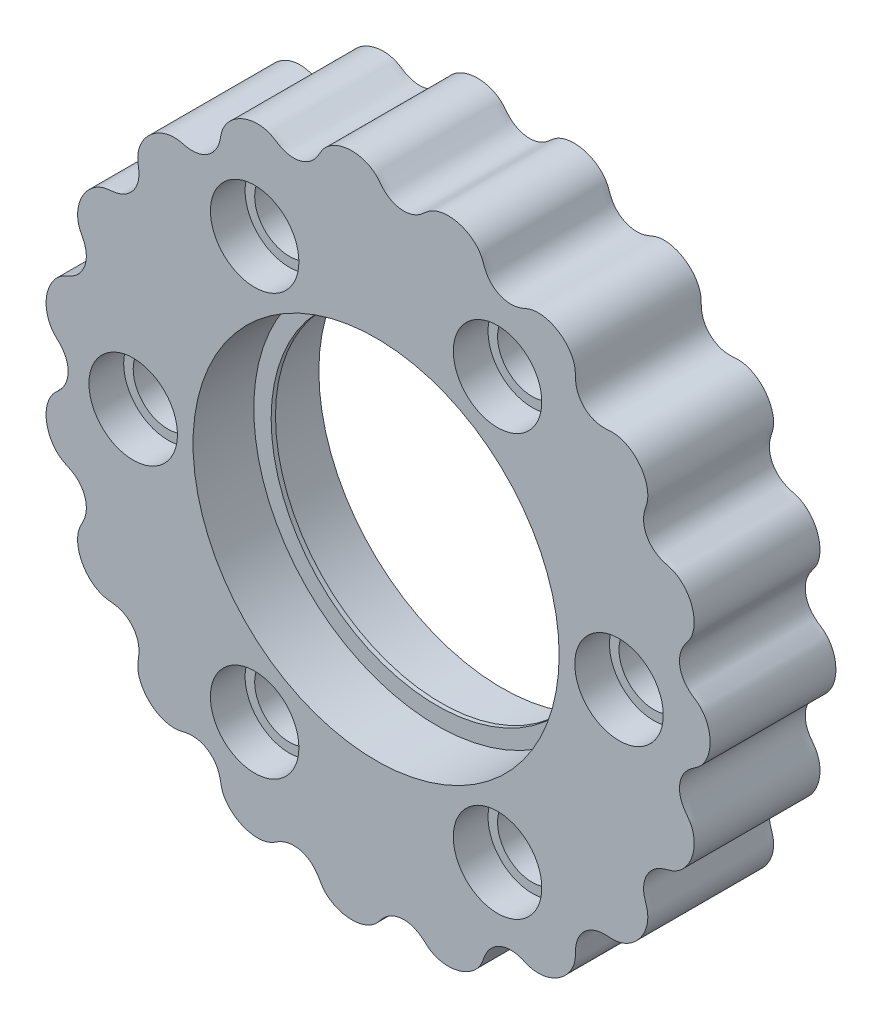
from build123d import *

# Parameters (mm, degrees)
LOBEBASE_DEPTH      = 7.25
LOBEBASE_DEPTH_BACK = 7.25
SKETCH5_R           = 21.1
CUT_EXTRUDE1_DEPTH  = 7
CUT_EXTRUDE2_START  = -7
SKETCH6_R           = 21.1
CUT_EXTRUDE2_DEPTH  = 7
SKETCH7_R           = 19.1
CUT_EXTRUDE3_DEPTH  = 57.265991747
SKETCH8_R           = 5.1
CUT_EXTRUDE4_DEPTH  = 4
SKETCH10_R          = 4
CUT_EXTRUDE5_DEPTH  = 57.265991747
CIRPATTERN1_COUNT   = 6


with BuildPart() as part:
    # LobeBaseSketch → LobeBase (new, two sides: drawn at the far end of the back side and taken through both)
    with BuildSketch(Plane.XY.offset(-LOBEBASE_DEPTH_BACK)):
        with BuildLine():
            add(Edge.make_bspline(
                [(38.5, 0), (38.5, 0.117207131), (38.491188641, 0.350596331), (38.451924314, 0.696154768), (38.387949005, 1.031810236), (38.301399075, 1.353038855), (38.195142317, 1.655817646), (38.072654089, 1.936771964), (37.937855755, 2.193307985), (37.794911074, 2.42372926), (37.647971127, 2.62733921), (37.500848555, 2.804536836), (37.356582447, 2.956923814), (37.216815665, 3.087465094), (37.080823073, 3.200802718), (36.943847802, 3.303973606), (36.794013033, 3.408218255), (36.606382019, 3.533884271), (36.333173002, 3.723953805), (35.90671922, 4.074791001), (35.344303574, 4.750939097), (34.931529824, 5.829041366), (34.97187912, 6.982756498), (35.284276606, 7.804885086), (35.573707295, 8.275182273), (35.770397617, 8.543664137), (35.907058576, 8.723444913), (36.014926702, 8.870692569), (36.110980742, 9.012749171), (36.202804215, 9.164102573), (36.292611362, 9.332952966), (36.379580764, 9.523926326), (36.461195853, 9.739293517), (36.534062147, 9.979582641), (36.594444025, 10.243933117), (36.638641503, 10.530338257), (36.663267263, 10.835841558), (36.665454624, 11.156716472), (36.643012278, 11.488642754), (36.594534076, 11.826884233), (36.519468313, 12.166468466), (36.418149075, 12.502366369), (36.291791427, 12.829668576), (36.142451909, 13.143754597), (35.972955806, 13.440450577), (35.786792629, 13.716171427), (35.587981042, 13.968043315), (35.380903846, 14.19400289), (35.170112148, 14.392870135), (34.960094938, 14.564392488), (34.75500456, 14.709258966), (34.55831752, 14.829084915), (34.372388176, 14.926372017), (34.19780766, 15.004458011), (34.032382855, 15.067497967), (33.869329749, 15.120602974), (33.69376526, 15.170548091), (33.475496922, 15.228481485), (33.155375648, 15.319541704), (32.638111656, 15.512900257), (31.886624314, 15.969796722), (31.146156549, 16.855457019), (30.809708917, 17.959762078), (30.838235131, 18.838780769), (30.959278419, 19.377573948), (31.058135598, 19.695373968), (31.129017167, 19.909787466), (31.183229464, 20.084081561), (31.227953328, 20.249629841), (31.265657183, 20.422597531), (31.295772698, 20.611459477), (31.316020909, 20.820324292), (31.323284256, 21.050522671), (31.314180702, 21.301451914), (31.285456464, 21.571085116), (31.234263603, 21.856322933), (31.158358312, 22.153269194), (31.056239242, 22.457468455), (30.927236596, 22.764123037), (30.771558249, 23.068296813), (30.590296935, 23.365107622), (30.385401582, 23.649907348), (30.159615487, 23.918447157), (29.916384032, 24.167024669), (29.659734668, 24.392609548), (29.394131911, 24.592943997), (29.124309817, 24.766614755), (28.85508368, 24.913093361), (28.591141168, 25.032741478), (28.336810054, 25.1267778), (28.09579397, 25.197202275), (27.870856554, 25.246671546), (27.663412304, 25.278316206), (27.472936562, 25.295485084), (27.296005888, 25.301396015), (27.124544282, 25.29868039), (26.942275208, 25.288913645), (26.717022309, 25.272836435), (26.384678883, 25.255019553), (25.832658261, 25.269946062), (24.973534536, 25.458079076), (23.98561393, 26.055322364), (23.308828692, 26.990548762), (23.050392374, 27.831202242), (22.989931344, 28.380104812), (22.98024267, 28.712784423), (22.977663732, 28.938595615), (22.972345457, 29.121048679), (22.96089262, 29.292148912), (22.940391059, 29.467987157), (22.907551459, 29.656394533), (22.858884271, 29.86051706), (22.791008778, 30.08060106), (22.700921888, 30.314978346), (22.58620425, 30.560675333), (22.445168593, 30.813835883), (22.276957767, 31.070046369), (22.081598451, 31.324605267), (21.860014944, 31.572757368), (21.614006615, 31.809901492), (21.346192227, 32.031774821), (21.05992435, 32.2346139), (20.759177235, 32.415290856), (20.448411745, 32.571422628), (20.132421061, 32.701450784), (19.816160905, 32.804689486), (19.504567712, 32.881339192), (19.202367464, 32.9324636), (18.913876406, 32.959926858), (18.642792109, 32.966286855), (18.391968152, 32.954637743), (18.163155819, 32.928389573), (17.956676467, 32.8909626), (17.7709465, 32.845353849), (17.601683142, 32.793495214), (17.440393561, 32.735253236), (17.271171585, 32.666833009), (17.063343771, 32.57848741), (16.754792761, 32.453724161), (16.227835509, 32.288601108), (15.354174788, 32.187583538), (14.225857866, 32.431689242), (13.282075205, 33.096490686), (12.76468194, 33.807681107), (12.529268482, 34.307210957), (12.412083874, 34.618719162), (12.336323896, 34.8314579), (12.272051367, 35.002298313), (12.205662921, 35.160409133), (12.129177606, 35.320063131), (12.036941571, 35.487599075), (11.92463283, 35.664859471), (11.78897386, 35.850979577), (11.627665946, 36.043406488), (11.439386346, 36.238542179), (11.223791293, 36.432191589), (10.981503184, 36.619901918), (10.714073836, 36.797235047), (10.423921479, 36.959993535), (10.114241988, 37.104409764), (9.788896371, 37.227302193), (9.452277535, 37.326199864), (9.109160017, 37.399434816), (8.764536755, 37.446201548), (8.423447245, 37.466582412), (8.090801385, 37.461537852), (7.771203052, 37.432860321), (7.468776779, 37.383090408), (7.186999657, 37.315392737), (6.928538367, 37.233387205), (6.695087203, 37.140926868), (6.487195321, 37.041805653), (6.304056108, 36.939362841), (6.143198641, 36.835918876), (5.99994491, 36.731910362), (5.866305582, 36.624453454), (5.728468531, 36.504794138), (5.56058717, 36.353753766), (5.309264865, 36.135564185), (4.864474979, 35.808285215), (4.070951957, 35.429063883), (2.924509365, 35.29357936), (1.816002776, 35.615914299), (1.095720153, 36.120573143), (0.710864969, 36.516598464), (0.498883197, 36.773178515), (0.358151948, 36.949791257), (0.24189009, 37.090505809), (0.127760255, 37.218493455), (0.003579557, 37.344662218), (-0.138057708, 37.473171611), (-0.301837608, 37.604360961), (-0.4905793, 37.73634817), (-0.705628023, 37.865972267), (-0.94706657, 37.989400681), (-1.213857949, 38.102554033), (-1.503967664, 38.201422879), (-1.814486925, 38.282313442), (-2.141765622, 38.34204091), (-2.481557696, 38.378079503), (-2.829178297, 38.388673732), (-3.179670217, 38.372912897), (-3.527976032, 38.330769701), (-3.869111788, 38.263103492), (-4.198337784, 38.171628482), (-4.511322007, 38.058847316), (-4.804292042, 37.927950204), (-5.074171761, 37.782679311), (-5.318700024, 37.627156806), (-5.536530015, 37.465672315), (-5.727310328, 37.302420266), (-5.891753449, 37.141167328), (-6.031706547, 36.984809945), (-6.150260113, 36.834740525), (-6.251980453, 36.689853069), (-6.343487632, 36.544825853), (-6.435002975, 36.386894391), (-6.544745332, 36.189526815), (-6.71160426, 35.901555128), (-7.026026895, 35.447585996), (-7.653421686, 34.831255417), (-8.693755104, 34.330862519), (-9.846861732, 34.275800961), (-10.691979914, 34.519240611), (-11.184571794, 34.768845913), (-11.468379215, 34.942693381), (-11.658831321, 35.064041395), (-11.814483731, 35.159381481), (-11.963987218, 35.243376507), (-12.122406393, 35.322387691), (-12.298096292, 35.397944547), (-12.495599257, 35.468846449), (-12.716970581, 35.5323979), (-12.962456246, 35.5851724), (-13.230890128, 35.623518154), (-13.519966847, 35.643913526), (-13.826460279, 35.643226914), (-14.146419873, 35.618909164), (-14.475359185, 35.569133214), (-14.808442099, 35.49288883), (-15.140667598, 35.390036811), (-15.467051363, 35.2613254), (-15.782801135, 35.108370926), (-16.083482033, 34.93360446), (-16.365167769, 34.740186312), (-16.624573659, 34.531890129), (-16.859167547, 34.312958169), (-17.067255056, 34.087928653), (-17.248036028, 33.861434588), (-17.401629461, 33.637970491), (-17.529064917, 33.421617621), (-17.632239313, 33.215707218), (-17.713840207, 33.022379013), (-17.777242753, 32.841946488), (-17.826406724, 32.671880893), (-17.865865531, 32.50499932), (-17.901142059, 32.325910037), (-17.940853125, 32.103603095), (-18.005166922, 31.777055503), (-18.155149736, 31.245590808), (-18.548428335, 30.458939965), (-19.369916309, 29.647864025), (-20.442665981, 29.221372744), (-21.321038055, 29.177212737), (-21.867986657, 29.253349414), (-22.192864789, 29.325625227), (-22.41239931, 29.378558574), (-22.590574919, 29.418192616), (-22.759251035, 29.449092857), (-22.934741512, 29.472384375), (-23.125445318, 29.486800935), (-23.335268838, 29.489732068), (-23.565280775, 29.477960975), (-23.814601202, 29.448166942), (-24.080941442, 29.397274678), (-24.360977554, 29.322701915), (-24.650641383, 29.222534252), (-24.945368724, 29.095643394), (-25.240322971, 28.941758023), (-25.530602023, 28.761492924), (-25.811430632, 28.556340268), (-26.078337499, 28.328626161), (-26.32731484, 28.081435399), (-26.554957439, 27.818507334), (-26.758577895, 27.544105906), (-26.936294798, 27.26286683), (-27.087090651, 26.979624697), (-27.21083644, 26.699221996), (-27.308279698, 26.426300519), (-27.380992342, 26.165072617), (-27.431273331, 25.919064117), (-27.461998455, 25.690809836), (-27.476404422, 25.481460919), (-27.477785297, 25.290217953), (-27.469065221, 25.113403467), (-27.452199683, 24.942751743), (-27.427414636, 24.761911742), (-27.392791101, 24.538755841), (-27.347590369, 24.209018843), (-27.316880396, 23.657651031), (-27.433424965, 22.785925748), (-27.947046528, 21.75205943), (-28.823190171, 21.000355374), (-29.639630892, 20.673381133), (-30.181665849, 20.567798593), (-30.512409106, 20.530670546), (-30.737236071, 20.509453076), (-30.918626786, 20.489086111), (-31.088196856, 20.463543046), (-31.261741519, 20.428590901), (-31.446793516, 20.380304907), (-31.646199956, 20.314947638), (-31.859927145, 20.229129581), (-32.086064596, 20.11999566), (-32.321449096, 19.985380346), (-32.562098343, 19.823920564), (-32.803543, 19.635126569), (-33.041099805, 19.419413196), (-33.27010612, 19.178094272), (-33.486125071, 18.913342979), (-33.685124652, 18.628121159), (-33.863631119, 18.326080713), (-34.018855472, 18.011440618), (-34.148791164, 17.68884329), (-34.252280904, 17.363194234), (-34.329050437, 17.039488882), (-34.379707183, 16.722630256), (-34.405701477, 16.417240355), (-34.409247532, 16.127466743), (-34.393199842, 15.856783131), (-34.360877639, 15.607777841), (-34.315823948, 15.381914575), (-34.261473877, 15.17923115), (-34.200683444, 14.997901885), (-34.135024275, 14.8334991), (-34.063662035, 14.677569989), (-33.981501257, 14.514576089), (-33.876295118, 14.314753634), (-33.726478059, 14.017559349), (-33.5184032, 13.506037678), (-33.345584326, 12.643702916), (-33.495680612, 11.499081678), (-34.080274467, 10.503623646), (-34.746309815, 9.929267901), (-35.224693229, 9.653407652), (-35.525460447, 9.510899146), (-35.731216365, 9.4178301), (-35.896165688, 9.339669205), (-36.048254165, 9.260450822), (-36.201046756, 9.17104262), (-36.360393689, 9.065286609), (-36.527774268, 8.938723412), (-36.70205605, 8.78815811), (-36.880505025, 8.611510655), (-37.059426222, 8.407759947), (-37.234610523, 8.176909819), (-37.401671733, 7.919948252), (-37.556315038, 7.638788256), (-37.694557032, 7.336186427), (-37.812906876, 7.015638852), (-37.908512738, 6.681256078), (-37.979274859, 6.337620062), (-38.023925257, 5.989626769), (-38.042073493, 5.642318604), (-38.034217798, 5.300711049), (-38.00172079, 4.96961792), (-37.946748986, 4.653479349), (-37.872174899, 4.356195982), (-37.78143948, 4.080971701), (-37.678370474, 3.830165151), (-37.566947692, 3.605146655), (-37.450997451, 3.406150194), (-37.333781016, 3.232096155), (-37.21740686, 3.080330432), (-37.101923789, 2.94615494), (-36.983798052, 2.82184578), (-36.85316494, 2.6943609), (-36.688776914, 2.539525754), (-36.45057853, 2.307079795), (-36.087686926, 1.890835575), (-35.644232216, 1.131338686), (-35.414537962, 0), (-35.644232216, -1.131338686), (-36.087686926, -1.890835575), (-36.45057853, -2.307079795), (-36.688776914, -2.539525754), (-36.85316494, -2.6943609), (-36.983798052, -2.82184578), (-37.101923789, -2.94615494), (-37.21740686, -3.080330432), (-37.333781016, -3.232096155), (-37.450997451, -3.406150194), (-37.566947692, -3.605146655), (-37.678370474, -3.830165151), (-37.78143948, -4.080971701), (-37.872174899, -4.356195982), (-37.946748986, -4.653479349), (-38.00172079, -4.96961792), (-38.034217798, -5.300711049), (-38.042073493, -5.642318604), (-38.023925257, -5.989626769), (-37.979274859, -6.337620062), (-37.908512738, -6.681256078), (-37.812906876, -7.015638852), (-37.694557032, -7.336186427), (-37.556315038, -7.638788256), (-37.401671733, -7.919948252), (-37.234610523, -8.176909819), (-37.059426222, -8.407759947), (-36.880505025, -8.611510655), (-36.70205605, -8.78815811), (-36.527774268, -8.938723412), (-36.360393689, -9.065286609), (-36.201046756, -9.17104262), (-36.048254165, -9.260450822), (-35.896165688, -9.339669205), (-35.731216365, -9.4178301), (-35.525460447, -9.510899146), (-35.224693229, -9.653407652), (-34.746309815, -9.929267901), (-34.080274467, -10.503623646), (-33.495680612, -11.499081678), (-33.345584326, -12.643702916), (-33.5184032, -13.506037678), (-33.726478059, -14.017559349), (-33.876295118, -14.314753634), (-33.981501257, -14.514576089), (-34.063662035, -14.677569989), (-34.135024275, -14.8334991), (-34.200683444, -14.997901885), (-34.261473877, -15.17923115), (-34.315823948, -15.381914575), (-34.360877639, -15.607777841), (-34.393199842, -15.856783131), (-34.409247532, -16.127466743), (-34.405701477, -16.417240355), (-34.379707183, -16.722630256), (-34.329050437, -17.039488882), (-34.252280904, -17.363194234), (-34.148791164, -17.68884329), (-34.018855472, -18.011440618), (-33.863631119, -18.326080713), (-33.685124652, -18.628121159), (-33.486125071, -18.913342979), (-33.27010612, -19.178094272), (-33.041099805, -19.419413196), (-32.803543, -19.635126569), (-32.562098343, -19.823920564), (-32.321449096, -19.985380346), (-32.086064596, -20.11999566), (-31.859927145, -20.229129581), (-31.646199956, -20.314947638), (-31.446793516, -20.380304907), (-31.261741519, -20.428590901), (-31.088196856, -20.463543046), (-30.918626786, -20.489086111), (-30.737236071, -20.509453076), (-30.512409106, -20.530670546), (-30.181665849, -20.567798593), (-29.639630892, -20.673381133), (-28.823190171, -21.000355374), (-27.947046528, -21.75205943), (-27.433424965, -22.785925748), (-27.316880396, -23.657651031), (-27.347590369, -24.209018843), (-27.392791101, -24.538755841), (-27.427414636, -24.761911742), (-27.452199683, -24.942751743), (-27.469065221, -25.113403467), (-27.477785297, -25.290217953), (-27.476404422, -25.481460919), (-27.461998455, -25.690809836), (-27.431273331, -25.919064117), (-27.380992342, -26.165072617), (-27.308279698, -26.426300519), (-27.21083644, -26.699221996), (-27.087090651, -26.979624697), (-26.936294798, -27.26286683), (-26.758577895, -27.544105906), (-26.554957439, -27.818507334), (-26.32731484, -28.081435399), (-26.078337499, -28.328626161), (-25.811430632, -28.556340268), (-25.530602023, -28.761492924), (-25.240322971, -28.941758023), (-24.945368724, -29.095643394), (-24.650641383, -29.222534252), (-24.360977554, -29.322701915), (-24.080941442, -29.397274678), (-23.814601202, -29.448166942), (-23.565280775, -29.477960975), (-23.335268838, -29.489732068), (-23.125445318, -29.486800935), (-22.934741512, -29.472384375), (-22.759251035, -29.449092857), (-22.590574919, -29.418192616), (-22.41239931, -29.378558574), (-22.192864789, -29.325625227), (-21.867986657, -29.253349414), (-21.321038055, -29.177212737), (-20.442665981, -29.221372744), (-19.369916309, -29.647864025), (-18.548428335, -30.458939965), (-18.155149736, -31.245590808), (-18.005166922, -31.777055503), (-17.940853125, -32.103603095), (-17.901142059, -32.325910037), (-17.865865531, -32.50499932), (-17.826406724, -32.671880893), (-17.777242753, -32.841946488), (-17.713840207, -33.022379013), (-17.632239313, -33.215707218), (-17.529064917, -33.421617621), (-17.401629461, -33.637970491), (-17.248036028, -33.861434588), (-17.067255056, -34.087928653), (-16.859167547, -34.312958169), (-16.624573659, -34.531890129), (-16.365167769, -34.740186312), (-16.083482033, -34.93360446), (-15.782801135, -35.108370926), (-15.467051363, -35.2613254), (-15.140667598, -35.390036811), (-14.808442099, -35.49288883), (-14.475359185, -35.569133214), (-14.146419873, -35.618909164), (-13.826460279, -35.643226914), (-13.519966847, -35.643913526), (-13.230890128, -35.623518154), (-12.962456246, -35.5851724), (-12.716970581, -35.5323979), (-12.495599257, -35.468846449), (-12.298096292, -35.397944547), (-12.122406393, -35.322387691), (-11.963987218, -35.243376507), (-11.814483731, -35.159381481), (-11.658831321, -35.064041395), (-11.468379215, -34.942693381), (-11.184571794, -34.768845913), (-10.691979914, -34.519240611), (-9.846861732, -34.275800961), (-8.693755104, -34.330862519), (-7.653421686, -34.831255417), (-7.026026895, -35.447585996), (-6.71160426, -35.901555128), (-6.544745332, -36.189526815), (-6.435002975, -36.386894391), (-6.343487632, -36.544825853), (-6.251980453, -36.689853069), (-6.150260113, -36.834740525), (-6.031706547, -36.984809945), (-5.891753449, -37.141167328), (-5.727310328, -37.302420266), (-5.536530015, -37.465672315), (-5.318700024, -37.627156806), (-5.074171761, -37.782679311), (-4.804292042, -37.927950204), (-4.511322007, -38.058847316), (-4.198337784, -38.171628482), (-3.869111788, -38.263103492), (-3.527976032, -38.330769701), (-3.179670217, -38.372912897), (-2.829178297, -38.388673732), (-2.481557696, -38.378079503), (-2.141765622, -38.34204091), (-1.814486925, -38.282313442), (-1.503967664, -38.201422879), (-1.213857949, -38.102554033), (-0.94706657, -37.989400681), (-0.705628023, -37.865972267), (-0.4905793, -37.73634817), (-0.301837608, -37.604360961), (-0.138057708, -37.473171611), (0.003579557, -37.344662218), (0.127760255, -37.218493455), (0.24189009, -37.090505809), (0.358151948, -36.949791257), (0.498883197, -36.773178515), (0.710864969, -36.516598464), (1.095720153, -36.120573143), (1.816002776, -35.615914299), (2.924509365, -35.29357936), (4.070951957, -35.429063883), (4.864474979, -35.808285215), (5.309264865, -36.135564185), (5.56058717, -36.353753766), (5.728468531, -36.504794138), (5.866305582, -36.624453454), (5.99994491, -36.731910362), (6.143198641, -36.835918876), (6.304056108, -36.939362841), (6.487195321, -37.041805653), (6.695087203, -37.140926868), (6.928538367, -37.233387205), (7.186999657, -37.315392737), (7.468776779, -37.383090408), (7.771203052, -37.432860321), (8.090801385, -37.461537852), (8.423447245, -37.466582412), (8.764536755, -37.446201548), (9.109160017, -37.399434816), (9.452277535, -37.326199864), (9.788896371, -37.227302193), (10.114241988, -37.104409764), (10.423921479, -36.959993535), (10.714073836, -36.797235047), (10.981503184, -36.619901918), (11.223791293, -36.432191589), (11.439386346, -36.238542179), (11.627665946, -36.043406488), (11.78897386, -35.850979577), (11.92463283, -35.664859471), (12.036941571, -35.487599075), (12.129177606, -35.320063131), (12.205662921, -35.160409133), (12.272051367, -35.002298313), (12.336323896, -34.8314579), (12.412083874, -34.618719162), (12.529268482, -34.307210957), (12.76468194, -33.807681107), (13.282075205, -33.096490686), (14.225857866, -32.431689242), (15.354174788, -32.187583538), (16.227835509, -32.288601108), (16.754792761, -32.453724161), (17.063343771, -32.57848741), (17.271171585, -32.666833009), (17.440393561, -32.735253236), (17.601683142, -32.793495214), (17.7709465, -32.845353849), (17.956676467, -32.8909626), (18.163155819, -32.928389573), (18.391968152, -32.954637743), (18.642792109, -32.966286855), (18.913876406, -32.959926858), (19.202367464, -32.9324636), (19.504567712, -32.881339192), (19.816160905, -32.804689486), (20.132421061, -32.701450784), (20.448411745, -32.571422628), (20.759177235, -32.415290856), (21.05992435, -32.2346139), (21.346192227, -32.031774821), (21.614006615, -31.809901492), (21.860014944, -31.572757368), (22.081598451, -31.324605267), (22.276957767, -31.070046369), (22.445168593, -30.813835883), (22.58620425, -30.560675333), (22.700921888, -30.314978346), (22.791008778, -30.08060106), (22.858884271, -29.86051706), (22.907551459, -29.656394533), (22.940391059, -29.467987157), (22.96089262, -29.292148912), (22.972345457, -29.121048679), (22.977663732, -28.938595615), (22.98024267, -28.712784423), (22.989931344, -28.380104812), (23.050392374, -27.831202242), (23.308828692, -26.990548762), (23.98561393, -26.055322364), (24.973534536, -25.458079076), (25.832658261, -25.269946062), (26.384678883, -25.255019553), (26.717022309, -25.272836435), (26.942275208, -25.288913645), (27.124544282, -25.29868039), (27.296005888, -25.301396015), (27.472936562, -25.295485084), (27.663412304, -25.278316206), (27.870856554, -25.246671546), (28.09579397, -25.197202275), (28.336810054, -25.1267778), (28.591141168, -25.032741478), (28.85508368, -24.913093361), (29.124309817, -24.766614755), (29.394131911, -24.592943997), (29.659734668, -24.392609548), (29.916384032, -24.167024669), (30.159615487, -23.918447157), (30.385401582, -23.649907348), (30.590296935, -23.365107622), (30.771558249, -23.068296813), (30.927236596, -22.764123037), (31.056239242, -22.457468455), (31.158358312, -22.153269194), (31.234263603, -21.856322933), (31.285456464, -21.571085116), (31.314180702, -21.301451914), (31.323284256, -21.050522671), (31.316020909, -20.820324292), (31.295772698, -20.611459477), (31.265657183, -20.422597531), (31.227953328, -20.249629841), (31.183229464, -20.084081561), (31.129017167, -19.909787466), (31.058135598, -19.695373968), (30.959278419, -19.377573948), (30.838235131, -18.838780769), (30.809708917, -17.959762078), (31.146156549, -16.855457019), (31.886624314, -15.969796722), (32.638111656, -15.512900257), (33.155375648, -15.319541704), (33.475496922, -15.228481485), (33.69376526, -15.170548091), (33.869329749, -15.120602974), (34.032382855, -15.067497967), (34.19780766, -15.004458011), (34.372388176, -14.926372017), (34.55831752, -14.829084915), (34.75500456, -14.709258966), (34.960094938, -14.564392488), (35.170112148, -14.392870135), (35.380903846, -14.19400289), (35.587981042, -13.968043315), (35.786792629, -13.716171427), (35.972955806, -13.440450577), (36.142451909, -13.143754597), (36.291791427, -12.829668576), (36.418149075, -12.502366369), (36.519468313, -12.166468466), (36.594534076, -11.826884233), (36.643012278, -11.488642754), (36.665454624, -11.156716472), (36.663267263, -10.835841558), (36.638641503, -10.530338257), (36.594444025, -10.243933117), (36.534062147, -9.979582641), (36.461195853, -9.739293517), (36.379580764, -9.523926326), (36.292611362, -9.332952966), (36.202804215, -9.164102573), (36.110980742, -9.012749171), (36.014926702, -8.870692569), (35.907058576, -8.723444913), (35.770397617, -8.543664137), (35.573707295, -8.275182273), (35.284276606, -7.804885086), (34.97187912, -6.982756498), (34.931529824, -5.829041366), (35.344303574, -4.750939097), (35.90671922, -4.074791001), (36.333173002, -3.723953805), (36.606382019, -3.533884271), (36.794013033, -3.408218255), (36.943847802, -3.303973606), (37.080823073, -3.200802718), (37.216815665, -3.087465094), (37.356582447, -2.956923814), (37.500848555, -2.804536836), (37.647971127, -2.62733921), (37.794911074, -2.42372926), (37.937855755, -2.193307985), (38.072654089, -1.936771964), (38.195142317, -1.655817646), (38.301399075, -1.353038855), (38.387949005, -1.031810236), (38.451924314, -0.696154768), (38.491188641, -0.350596331), (38.5, -0.117207131), (38.5, 0)],
                knots=[0, 0, 0, 0, 0.001307561, 0.002603687, 0.003877103, 0.005116864, 0.006312543, 0.007454444, 0.008533868, 0.009543461, 0.010477685, 0.011333521, 0.012111543, 0.012817691, 0.013466347, 0.014086028, 0.014730603, 0.015502879, 0.016606009, 0.018443649, 0.021651303, 0.026315789, 0.030980276, 0.03418793, 0.03602557, 0.0371287, 0.037900976, 0.038545551, 0.039165232, 0.039813888, 0.040520036, 0.041298058, 0.042153894, 0.043088118, 0.044097711, 0.045177135, 0.046319036, 0.047514715, 0.048754476, 0.050027892, 0.051324018, 0.052631579, 0.05393914, 0.055235266, 0.056508682, 0.057748443, 0.058944122, 0.060086023, 0.061165447, 0.06217504, 0.063109264, 0.0639651, 0.064743122, 0.06544927, 0.066097926, 0.066717607, 0.067362182, 0.068134458, 0.069237588, 0.071075228, 0.074282882, 0.078947368, 0.083611855, 0.086819509, 0.088657148, 0.089760278, 0.090532555, 0.09117713, 0.091796811, 0.092445467, 0.093151615, 0.093929637, 0.094785473, 0.095719697, 0.09672929, 0.097808714, 0.098950615, 0.100146293, 0.101386055, 0.102659471, 0.103955597, 0.105263158, 0.106570719, 0.107866845, 0.109140261, 0.110380022, 0.111575701, 0.112717602, 0.113797026, 0.114806619, 0.115740843, 0.116596679, 0.117374701, 0.118080849, 0.118729505, 0.119349186, 0.119993761, 0.120766037, 0.121869167, 0.123706807, 0.126914461, 0.131578947, 0.136243434, 0.139451088, 0.141288727, 0.142391857, 0.143164134, 0.143808709, 0.14442839, 0.145077046, 0.145783194, 0.146561216, 0.147417052, 0.148351276, 0.149360869, 0.150440293, 0.151582193, 0.152777872, 0.154017634, 0.15529105, 0.156587175, 0.157894737, 0.159202298, 0.160498424, 0.16177184, 0.163011601, 0.16420728, 0.165349181, 0.166428605, 0.167438198, 0.168372422, 0.169228258, 0.17000628, 0.170712428, 0.171361084, 0.171980765, 0.17262534, 0.173397616, 0.174500746, 0.176338386, 0.17954604, 0.184210526, 0.188875012, 0.192082667, 0.193920306, 0.195023436, 0.195795713, 0.196440288, 0.197059969, 0.197708625, 0.198414773, 0.199192795, 0.200048631, 0.200982855, 0.201992448, 0.203071872, 0.204213772, 0.205409451, 0.206649213, 0.207922629, 0.209218754, 0.210526316, 0.211833877, 0.213130003, 0.214403419, 0.21564318, 0.216838859, 0.21798076, 0.219060184, 0.220069777, 0.221004001, 0.221859837, 0.222637859, 0.223344007, 0.223992663, 0.224612344, 0.225256919, 0.226029195, 0.227132325, 0.228969965, 0.232177619, 0.236842105, 0.241506591, 0.244714246, 0.246551885, 0.247655015, 0.248427291, 0.249071867, 0.249691547, 0.250340204, 0.251046351, 0.251824374, 0.25268021, 0.253614434, 0.254624026, 0.255703451, 0.256845351, 0.25804103, 0.259280792, 0.260554208, 0.261850333, 0.263157895, 0.264465456, 0.265761582, 0.267034998, 0.268274759, 0.269470438, 0.270612339, 0.271691763, 0.272701355, 0.27363558, 0.274491416, 0.275269438, 0.275975586, 0.276624242, 0.277243922, 0.277888498, 0.278660774, 0.279763904, 0.281601544, 0.284809198, 0.289473684, 0.29413817, 0.297345825, 0.299183464, 0.300286594, 0.30105887, 0.301703446, 0.302323126, 0.302971783, 0.30367793, 0.304455952, 0.305311788, 0.306246013, 0.307255605, 0.30833503, 0.30947693, 0.310672609, 0.311912371, 0.313185786, 0.314481912, 0.315789474, 0.317097035, 0.318393161, 0.319666577, 0.320906338, 0.322102017, 0.323243918, 0.324323342, 0.325332934, 0.326267159, 0.327122995, 0.327901017, 0.328607165, 0.329255821, 0.329875501, 0.330520077, 0.331292353, 0.332395483, 0.334233123, 0.337440777, 0.342105263, 0.346769749, 0.349977404, 0.351815043, 0.352918173, 0.353690449, 0.354335025, 0.354954705, 0.355603362, 0.356309509, 0.357087531, 0.357943367, 0.358877592, 0.359887184, 0.360966609, 0.362108509, 0.363304188, 0.36454395, 0.365817365, 0.367113491, 0.368421053, 0.369728614, 0.37102474, 0.372298156, 0.373537917, 0.374733596, 0.375875497, 0.376954921, 0.377964513, 0.378898738, 0.379754574, 0.380532596, 0.381238744, 0.3818874, 0.38250708, 0.383151656, 0.383923932, 0.385027062, 0.386864702, 0.390072356, 0.394736842, 0.399401328, 0.402608983, 0.404446622, 0.405549752, 0.406322028, 0.406966604, 0.407586284, 0.408234941, 0.408941088, 0.40971911, 0.410574946, 0.411509171, 0.412518763, 0.413598188, 0.414740088, 0.415935767, 0.417175529, 0.418448944, 0.41974507, 0.421052632, 0.422360193, 0.423656319, 0.424929735, 0.426169496, 0.427365175, 0.428507076, 0.4295865, 0.430596092, 0.431530317, 0.432386153, 0.433164175, 0.433870323, 0.434518979, 0.435138659, 0.435783235, 0.436555511, 0.437658641, 0.439496281, 0.442703935, 0.447368421, 0.452032907, 0.455240562, 0.457078201, 0.458181331, 0.458953607, 0.459598183, 0.460217863, 0.46086652, 0.461572667, 0.462350689, 0.463206525, 0.46414075, 0.465150342, 0.466229767, 0.467371667, 0.468567346, 0.469807108, 0.471080523, 0.472376649, 0.473684211, 0.474991772, 0.476287898, 0.477561314, 0.478801075, 0.479996754, 0.481138655, 0.482218079, 0.483227671, 0.484161896, 0.485017732, 0.485795754, 0.486501902, 0.487150558, 0.487770238, 0.488414814, 0.48918709, 0.49029022, 0.492127859, 0.495335514, 0.5, 0.504664486, 0.507872141, 0.50970978, 0.51081291, 0.511585186, 0.512229762, 0.512849442, 0.513498098, 0.514204246, 0.514982268, 0.515838104, 0.516772329, 0.517781921, 0.518861345, 0.520003246, 0.521198925, 0.522438686, 0.523712102, 0.525008228, 0.526315789, 0.527623351, 0.528919477, 0.530192892, 0.531432654, 0.532628333, 0.533770233, 0.534849658, 0.53585925, 0.536793475, 0.537649311, 0.538427333, 0.53913348, 0.539782137, 0.540401817, 0.541046393, 0.541818669, 0.542921799, 0.544759438, 0.547967093, 0.552631579, 0.557296065, 0.560503719, 0.562341359, 0.563444489, 0.564216765, 0.564861341, 0.565481021, 0.566129677, 0.566835825, 0.567613847, 0.568469683, 0.569403908, 0.5704135, 0.571492924, 0.572634825, 0.573830504, 0.575070265, 0.576343681, 0.577639807, 0.578947368, 0.58025493, 0.581551056, 0.582824471, 0.584064233, 0.585259912, 0.586401812, 0.587481237, 0.588490829, 0.589425054, 0.59028089, 0.591058912, 0.591765059, 0.592413716, 0.593033396, 0.593677972, 0.594450248, 0.595553378, 0.597391017, 0.600598672, 0.605263158, 0.609927644, 0.613135298, 0.614972938, 0.616076068, 0.616848344, 0.61749292, 0.6181126, 0.618761256, 0.619467404, 0.620245426, 0.621101262, 0.622035487, 0.623045079, 0.624124503, 0.625266404, 0.626462083, 0.627701844, 0.62897526, 0.630271386, 0.631578947, 0.632886509, 0.634182635, 0.63545605, 0.636695812, 0.637891491, 0.639033391, 0.640112816, 0.641122408, 0.642056633, 0.642912469, 0.643690491, 0.644396638, 0.645045295, 0.645664975, 0.646309551, 0.647081827, 0.648184957, 0.650022596, 0.653230251, 0.657894737, 0.662559223, 0.665766877, 0.667604517, 0.668707647, 0.669479923, 0.670124499, 0.670744179, 0.671392835, 0.672098983, 0.672877005, 0.673732841, 0.674667066, 0.675676658, 0.676756082, 0.677897983, 0.679093662, 0.680333423, 0.681606839, 0.682902965, 0.684210526, 0.685518088, 0.686814214, 0.688087629, 0.689327391, 0.69052307, 0.69166497, 0.692744395, 0.693753987, 0.694688212, 0.695544048, 0.69632207, 0.697028217, 0.697676874, 0.698296554, 0.69894113, 0.699713406, 0.700816536, 0.702654175, 0.70586183, 0.710526316, 0.715190802, 0.718398456, 0.720236096, 0.721339226, 0.722111502, 0.722756078, 0.723375758, 0.724024414, 0.724730562, 0.725508584, 0.72636442, 0.727298645, 0.728308237, 0.729387661, 0.730529562, 0.731725241, 0.732965002, 0.734238418, 0.735534544, 0.736842105, 0.738149667, 0.739445792, 0.740719208, 0.74195897, 0.743154649, 0.744296549, 0.745375974, 0.746385566, 0.74731979, 0.748175626, 0.748953649, 0.749659796, 0.750308453, 0.750928133, 0.751572709, 0.752344985, 0.753448115, 0.755285754, 0.758493409, 0.763157895, 0.767822381, 0.771030035, 0.772867675, 0.773970805, 0.774743081, 0.775387656, 0.776007337, 0.776655993, 0.777362141, 0.778140163, 0.778995999, 0.779930223, 0.780939816, 0.78201924, 0.783161141, 0.78435682, 0.785596581, 0.786869997, 0.788166123, 0.789473684, 0.790781246, 0.792077371, 0.793350787, 0.794590549, 0.795786228, 0.796928128, 0.798007552, 0.799017145, 0.799951369, 0.800807205, 0.801585227, 0.802291375, 0.802940031, 0.803559712, 0.804204287, 0.804976564, 0.806079694, 0.807917333, 0.811124988, 0.815789474, 0.82045396, 0.823661614, 0.825499254, 0.826602384, 0.82737466, 0.828019235, 0.828638916, 0.829287572, 0.82999372, 0.830771742, 0.831627578, 0.832561802, 0.833571395, 0.834650819, 0.83579272, 0.836988399, 0.83822816, 0.839501576, 0.840797702, 0.842105263, 0.843412825, 0.84470895, 0.845982366, 0.847222128, 0.848417807, 0.849559707, 0.850639131, 0.851648724, 0.852582948, 0.853438784, 0.854216806, 0.854922954, 0.85557161, 0.856191291, 0.856835866, 0.857608143, 0.858711273, 0.860548912, 0.863756566, 0.868421053, 0.873085539, 0.876293193, 0.878130833, 0.879233963, 0.880006239, 0.880650814, 0.881270495, 0.881919151, 0.882625299, 0.883403321, 0.884259157, 0.885193381, 0.886202974, 0.887282398, 0.888424299, 0.889619978, 0.890859739, 0.892133155, 0.893429281, 0.894736842, 0.896044403, 0.897340529, 0.898613945, 0.899853707, 0.901049385, 0.902191286, 0.90327071, 0.904280303, 0.905214527, 0.906070363, 0.906848385, 0.907554533, 0.908203189, 0.90882287, 0.909467445, 0.910239722, 0.911342852, 0.913180491, 0.916388145, 0.921052632, 0.925717118, 0.928924772, 0.930762412, 0.931865542, 0.932637818, 0.933282393, 0.933902074, 0.93455073, 0.935256878, 0.9360349, 0.936890736, 0.93782496, 0.938834553, 0.939913977, 0.941055878, 0.942251557, 0.943491318, 0.944764734, 0.94606086, 0.947368421, 0.948675982, 0.949972108, 0.951245524, 0.952485285, 0.953680964, 0.954822865, 0.955902289, 0.956911882, 0.957846106, 0.958701942, 0.959479964, 0.960186112, 0.960834768, 0.961454449, 0.962099024, 0.9628713, 0.96397443, 0.96581207, 0.969019724, 0.973684211, 0.978348697, 0.981556351, 0.983393991, 0.984497121, 0.985269397, 0.985913972, 0.986533653, 0.987182309, 0.987888457, 0.988666479, 0.989522315, 0.990456539, 0.991466132, 0.992545556, 0.993687457, 0.994883136, 0.996122897, 0.997396313, 0.998692439, 1, 1, 1, 1], degree=3))
        make_face()
    extrude(amount=LOBEBASE_DEPTH + LOBEBASE_DEPTH_BACK)

    # Sketch5 → Cut-Extrude1 (cut)
    with BuildSketch(Plane.XY.offset(7.25)):
        Circle(SKETCH5_R)
    extrude(amount=-CUT_EXTRUDE1_DEPTH, mode=Mode.SUBTRACT)

    # Sketch6 → Cut-Extrude2 (cut)
    with BuildSketch(Plane(origin=(0, 0, -7.25), x_dir=(-1, 0, 0), z_dir=(0, 0, -1)).offset(CUT_EXTRUDE2_START)):
        Circle(SKETCH6_R)
    extrude(amount=CUT_EXTRUDE2_DEPTH, mode=Mode.SUBTRACT)

    # Sketch7 → Cut-Extrude3 (cut, through all)
    with BuildSketch(Plane.XY.offset(7.25)):
        Circle(SKETCH7_R)
    extrude(amount=-CUT_EXTRUDE3_DEPTH, mode=Mode.SUBTRACT)

    # Sketch8 → Cut-Extrude4 (cut)
    with BuildSketch(Plane.XY.offset(7.25)):
        with Locations((28, 0)):
            Circle(SKETCH8_R)
    cut_extrude4 = extrude(amount=-CUT_EXTRUDE4_DEPTH, mode=Mode.SUBTRACT)

    # Sketch10 → Cut-Extrude5 (cut, through all)
    with BuildSketch(Plane(origin=(0, 0, -7.25), x_dir=(-1, 0, 0), z_dir=(0, 0, -1))):
        with Locations((-28, 0)):
            Circle(SKETCH10_R)
    cut_extrude5 = extrude(amount=-CUT_EXTRUDE5_DEPTH, mode=Mode.SUBTRACT)

    # CirPattern1: Cut-Extrude4, Cut-Extrude5 ×6 about axis
    cirpattern1_axis = Axis((0, 0, 7.25), (0, 0, 1))
    add([cut_extrude4.rotate(cirpattern1_axis, i * 360 / CIRPATTERN1_COUNT) for i in range(1, CIRPATTERN1_COUNT)], mode=Mode.SUBTRACT)
    add([cut_extrude5.rotate(cirpattern1_axis, i * 360 / CIRPATTERN1_COUNT) for i in range(1, CIRPATTERN1_COUNT)], mode=Mode.SUBTRACT)


solid = part.part
